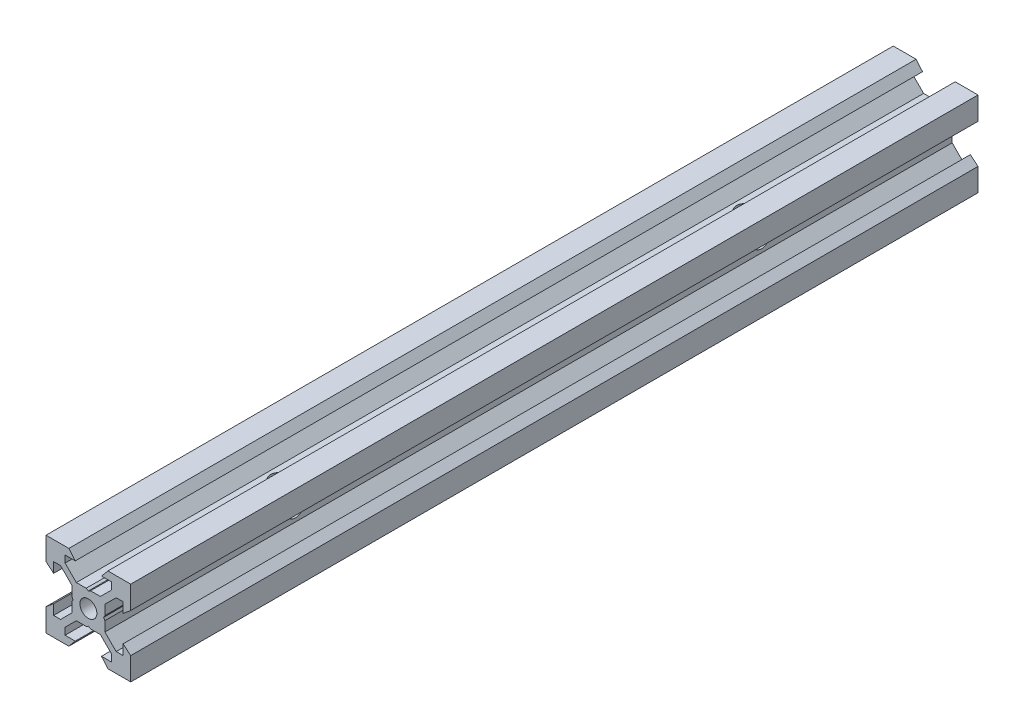
from build123d import *

# Parameters (mm, degrees)
SKETCH1_R               = 2
BOSS_EXTRUDE1_DEPTH     = 200
CUT_EXTRUDE1_DEPTH      = 201.731686587
CUT_EXTRUDE1_DEPTH_BACK = 201.731686587
SKETCH2_R               = 2
CUT_EXTRUDE2_DEPTH      = 201.731686587
CUT_EXTRUDE2_DEPTH_BACK = 201.731686587
SKETCH3_R               = 2


with BuildPart() as part:
    # Sketch1 → Boss-Extrude1 (new body)
    with BuildSketch(Plane.XY):
        Polygon((10, 10), (10, 4.610379336), (8.2, 3.1), (8.2, 5.5), (6.560660172, 5.5), (3.9, 2.839339828), (3.9, 0.519615242), (3.6, 0), (3.9, -0.519615242), (3.9, -2.839339828), (6.560660172, -5.5), (8.2, -5.5), (8.2, -3.1), (10, -4.610379336), (10, -10), (4.610379336, -10), (3.1, -8.2), (5.5, -8.2), (5.5, -6.560660172), (2.839339828, -3.9), (0.519615242, -3.9), (0, -3.6), (-0.519615242, -3.9), (-2.839339828, -3.9), (-5.5, -6.560660172), (-5.5, -8.2), (-3.1, -8.2), (-4.610379336, -10), (-10, -10), (-10, -4.610379336), (-8.2, -3.1), (-8.2, -5.5), (-6.560660172, -5.5), (-3.9, -2.839339828), (-3.9, -0.519615242), (-3.6, 0), (-3.9, 0.519615242), (-3.9, 2.839339828), (-6.560660172, 5.5), (-8.2, 5.5), (-8.2, 3.1), (-10, 4.610379336), (-10, 10), (-4.610379336, 10), (-3.1, 8.2), (-5.5, 8.2), (-5.5, 6.560660172), (-2.839339828, 3.9), (-0.519615242, 3.9), (0, 3.6), (0.519615242, 3.9), (2.839339828, 3.9), (5.5, 6.560660172), (5.5, 8.2), (3.1, 8.2), (4.610379336, 10), align=None)
        Circle(SKETCH1_R, mode=Mode.SUBTRACT)
    extrude(amount=BOSS_EXTRUDE1_DEPTH)

    # Sketch2 → Cut-Extrude1 (cut, two sides: drawn at the far end of the back side and taken through both)
    with BuildSketch(Plane(origin=(0, -3.9, 0), x_dir=(-1, 0, 0), z_dir=(0, -1, 0)).offset(-CUT_EXTRUDE1_DEPTH_BACK)):
        with Locations(Location((0, -155, 0), (0, 0, 90))):
            Circle(SKETCH2_R)
        with Locations(Location((0, -45, 0), (0, 0, 90))):
            Circle(SKETCH2_R)
    extrude(amount=CUT_EXTRUDE1_DEPTH + CUT_EXTRUDE1_DEPTH_BACK, mode=Mode.SUBTRACT)

    # Sketch3 → Cut-Extrude2 (cut, two sides: drawn at the far end of the back side and taken through both)
    with BuildSketch(Plane(origin=(3.9, 0, 0), x_dir=(0, 0, -1), z_dir=(1, 0, 0)).offset(-CUT_EXTRUDE2_DEPTH_BACK)):
        with Locations(Location((-45, 0, 0), (0, 0, 45))):
            Circle(SKETCH3_R)
        with Locations(Location((-155, 0, 0), (0, 0, 45))):
            Circle(SKETCH3_R)
    extrude(amount=CUT_EXTRUDE2_DEPTH + CUT_EXTRUDE2_DEPTH_BACK, mode=Mode.SUBTRACT)


solid = part.part
